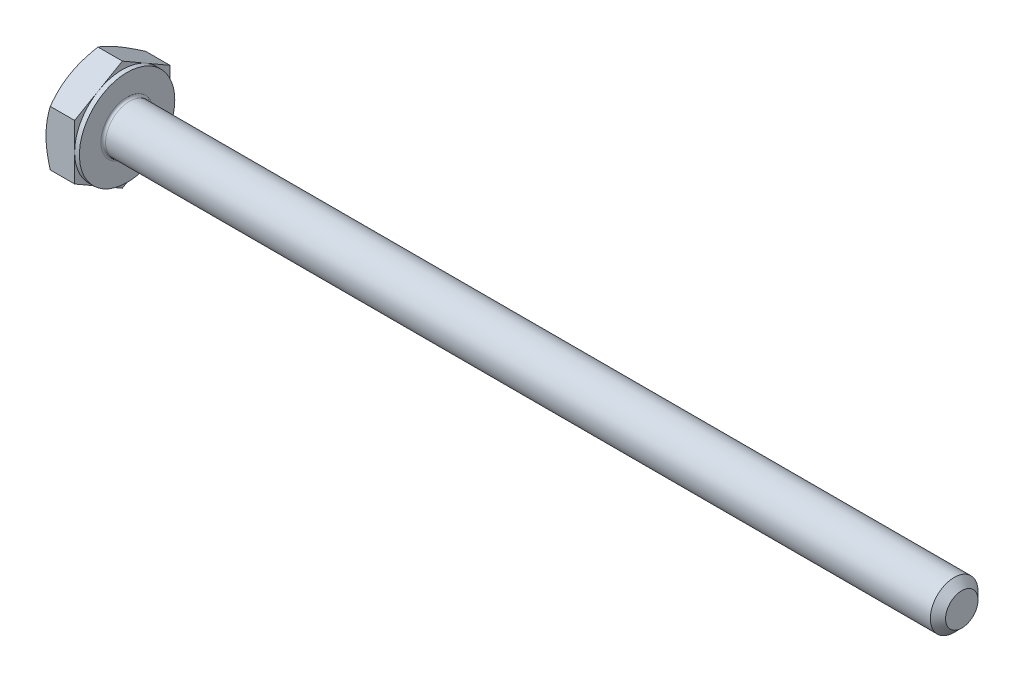
from build123d import *

# Parameters (mm, degrees)
EXTRUDE_360_DEPTH = 1.4
SKETCH_4_W        = 0.2
SKETCH_4_H        = 10.309401077
CHAMFER_1921_SIZE = 0.32
FILLET_1966_R     = 0.1


with BuildPart() as part:
    # 草图1 → Extrude 360 (new body)
    with BuildSketch(Plane(origin=(0, 0, 0), x_dir=(0, 0, -1), z_dir=(1, 0, 0))):
        Polygon((2, 1.154700538), (2, -1.154700538), (0, -2.309401077), (-2, -1.154700538), (-2, 1.154700538), (0, 2.309401077), align=None)
    extrude(amount=EXTRUDE_360_DEPTH)

    # 草图2 → 凸台-旋转1 (revolve)
    with BuildSketch(Plane.XY, mode=Mode.PRIVATE) as revolve_1_sk:
        Polygon((0, 0), (36.4, 0), (36.4, 0.6536), (36.4, 1), (0, 1), align=None)
    revolve(revolve_1_sk.sketch.rotate(Axis((0, 0, 0), (1, 0, 0)), 90), axis=Axis((0, 0, 0), (1, 0, 0)))

    # 草图3 → 切除-旋转1 (revolve, cut)
    with BuildSketch(Plane.XY):
        Polygon((0, 2), (3.065384141, 7.309401077), (3.065384141, 12.309401077), (-10, 12.309401077), (-10, 2), align=None)
    revolve(axis=Axis((0, 0, 0), (1, 0, 0)), mode=Mode.SUBTRACT)

    # 草图5 → 切除-旋转2 (revolve, cut)
    with BuildSketch(Plane.XY):
        Polygon((1.4, 2), (-1.665384141, 7.309401077), (-1.665384141, 12.309401077), (8.334615859, 12.309401077), (8.334615859, 2), align=None)
    revolve(axis=Axis((0, 0, 0), (1, 0, 0)), mode=Mode.SUBTRACT)

    # 草图4 → 切除-旋转3 (revolve, cut)
    with BuildSketch(Plane.XY, mode=Mode.PRIVATE) as cut_revolve_3_sk:
        with Locations((1.3, 7.154700539)):
            Rectangle(SKETCH_4_W, SKETCH_4_H)
    revolve(cut_revolve_3_sk.sketch.rotate(Axis((0, 0, 0), (1, 0, 0)), 270), axis=Axis((0, 0, 0), (1, 0, 0)), mode=Mode.SUBTRACT)

    # Chamfer 1921
    chamfer_1921_edges = [part.edges().sort_by_distance(p)[0] for p in [
        (36.4, 0, -1),
    ]]
    chamfer(chamfer_1921_edges, length=CHAMFER_1921_SIZE)

    # Fillet 1966
    fillet_1966_edges = [part.edges().sort_by_distance(p)[0] for p in [
        (1.4, 0, -1),
    ]]
    fillet(fillet_1966_edges, radius=FILLET_1966_R)


solid = part.part
